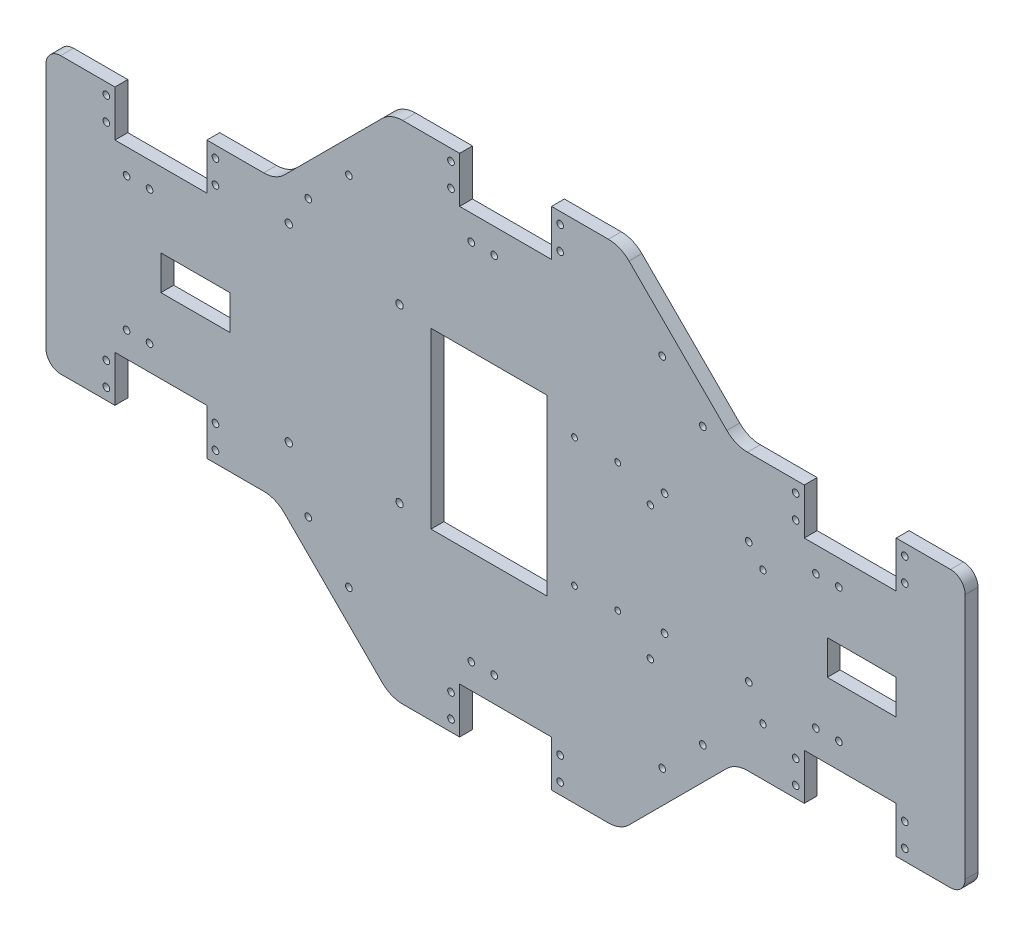
from build123d import *

# Parameters (mm, degrees)
BOSS_EXTRU_1_DEPTH       = 5.6
ENL_V_MAT_EXTRU_1_REACH  = 416.887
ESQUISSE2_W              = 40
ESQUISSE2_H              = 20
ENL_V_MAT_EXTRU_2_REACH  = 416.887
ESQUISSE3_R              = 1.45
SKETCH2_W                = 40
SKETCH2_H                = 20
CUT_EXTRUDE2_DEPTH       = 415.887165384
SKETCH5_R                = 1.45
CUT_EXTRUDE4_DEPTH       = 415.887165384
ESQUISSE4_R              = 1.375
ENL_V_MAT_EXTRU_4_DEPTH  = 415.887165384
ESQUISSE6_R              = 1.45
ENL_V_MAT_EXTRU_6_DEPTH  = 415.887165384
ESQUISSE8_R              = 1.25
ENL_V_MAT_EXTRU_7_DEPTH  = 415.887165384
ESQUISSE9_R              = 1.6
ENL_V_MAT_EXTRU_8_DEPTH  = 415.887165384
ESQUISSE10_W             = 50.45
ESQUISSE10_H             = 75.69
ENL_V_MAT_EXTRU_9_DEPTH  = 415.887165384
ESQUISSE11_W             = 30
ESQUISSE11_H             = 15
ENL_V_MAT_EXTRU_10_DEPTH = 415.887165384
ESQUISSE12_R             = 1.45
ENL_V_MAT_EXTRU_11_DEPTH = 415.887165384
FILLET1_R                = 6.35
FILLET2_R                = 12.7


with BuildPart() as part:
    # Esquisse1 → Boss.-Extru.1 (new body)
    with BuildSketch(Plane.XY):
        Polygon((100, -60), (150, -110), (250, -110), (300, -60), (400, -60), (400, 0), (25.838605695, 0), (0, 0), (0, -60), align=None)
    boss_extru_1 = extrude(amount=BOSS_EXTRU_1_DEPTH)

    # Esquisse2 → Enlèv. mat.-Extru.1 (cut, up to next)
    with BuildSketch(Plane.XY.offset(5.6), mode=Mode.PRIVATE) as enl_v_mat_extru_1_sk1:
        with Locations((50, -50)):
            Rectangle(ESQUISSE2_W, ESQUISSE2_H)
    enl_v_mat_extru_1_tool1 = extrude(enl_v_mat_extru_1_sk1.sketch, amount=-ENL_V_MAT_EXTRU_1_REACH, mode=Mode.PRIVATE) & part.part
    enl_v_mat_extru_1 = enl_v_mat_extru_1_tool1.solids().sort_by_distance((50, -50, 5.6))[0]
    add(enl_v_mat_extru_1, mode=Mode.SUBTRACT)

    # Esquisse3 → Enlèv. mat.-Extru.2 (cut, up to next)
    with BuildSketch(Plane.XY.offset(5.6), mode=Mode.PRIVATE) as enl_v_mat_extru_2_sk1:
        with Locations((26.25, -55.08)):
            Circle(ESQUISSE3_R)
    enl_v_mat_extru_2_tool1 = extrude(enl_v_mat_extru_2_sk1.sketch, amount=-ENL_V_MAT_EXTRU_2_REACH, mode=Mode.PRIVATE) & part.part
    # Esquisse3 → Enlèv. mat.-Extru.2 (cut, up to next)
    with BuildSketch(Plane.XY.offset(5.6), mode=Mode.PRIVATE) as enl_v_mat_extru_2_sk2:
        with Locations((73.75, -55.08)):
            Circle(ESQUISSE3_R)
    enl_v_mat_extru_2_tool2 = extrude(enl_v_mat_extru_2_sk2.sketch, amount=-ENL_V_MAT_EXTRU_2_REACH, mode=Mode.PRIVATE) & part.part
    # Esquisse3 → Enlèv. mat.-Extru.2 (cut, up to next)
    with BuildSketch(Plane.XY.offset(5.6), mode=Mode.PRIVATE) as enl_v_mat_extru_2_sk3:
        with Locations((73.75, -44.92)):
            Circle(ESQUISSE3_R)
    enl_v_mat_extru_2_tool3 = extrude(enl_v_mat_extru_2_sk3.sketch, amount=-ENL_V_MAT_EXTRU_2_REACH, mode=Mode.PRIVATE) & part.part
    # Esquisse3 → Enlèv. mat.-Extru.2 (cut, up to next)
    with BuildSketch(Plane.XY.offset(5.6), mode=Mode.PRIVATE) as enl_v_mat_extru_2_sk4:
        with Locations((26.25, -44.92)):
            Circle(ESQUISSE3_R)
    enl_v_mat_extru_2_tool4 = extrude(enl_v_mat_extru_2_sk4.sketch, amount=-ENL_V_MAT_EXTRU_2_REACH, mode=Mode.PRIVATE) & part.part
    # Esquisse3 → Enlèv. mat.-Extru.2 (cut, up to next)
    with BuildSketch(Plane.XY.offset(5.6), mode=Mode.PRIVATE) as enl_v_mat_extru_2_sk5:
        with Locations((35.06, -29.09)):
            Circle(ESQUISSE3_R)
    enl_v_mat_extru_2_tool5 = extrude(enl_v_mat_extru_2_sk5.sketch, amount=-ENL_V_MAT_EXTRU_2_REACH, mode=Mode.PRIVATE) & part.part
    # Esquisse3 → Enlèv. mat.-Extru.2 (cut, up to next)
    with BuildSketch(Plane.XY.offset(5.6), mode=Mode.PRIVATE) as enl_v_mat_extru_2_sk6:
        with Locations((45.06, -29.09)):
            Circle(ESQUISSE3_R)
    enl_v_mat_extru_2_tool6 = extrude(enl_v_mat_extru_2_sk6.sketch, amount=-ENL_V_MAT_EXTRU_2_REACH, mode=Mode.PRIVATE) & part.part
    enl_v_mat_extru_2_1 = enl_v_mat_extru_2_tool1.solids().sort_by_distance((26.25, -55.08, 5.6))[0]
    add(enl_v_mat_extru_2_1, mode=Mode.SUBTRACT)
    enl_v_mat_extru_2_2 = enl_v_mat_extru_2_tool2.solids().sort_by_distance((73.75, -55.08, 5.6))[0]
    add(enl_v_mat_extru_2_2, mode=Mode.SUBTRACT)
    enl_v_mat_extru_2_3 = enl_v_mat_extru_2_tool3.solids().sort_by_distance((73.75, -44.92, 5.6))[0]
    add(enl_v_mat_extru_2_3, mode=Mode.SUBTRACT)
    enl_v_mat_extru_2_4 = enl_v_mat_extru_2_tool4.solids().sort_by_distance((26.25, -44.92, 5.6))[0]
    add(enl_v_mat_extru_2_4, mode=Mode.SUBTRACT)
    enl_v_mat_extru_2_5 = enl_v_mat_extru_2_tool5.solids().sort_by_distance((35.06, -29.09, 5.6))[0]
    add(enl_v_mat_extru_2_5, mode=Mode.SUBTRACT)
    enl_v_mat_extru_2_6 = enl_v_mat_extru_2_tool6.solids().sort_by_distance((45.06, -29.09, 5.6))[0]
    add(enl_v_mat_extru_2_6, mode=Mode.SUBTRACT)
    enl_v_mat_extru_2 = enl_v_mat_extru_2_1 + enl_v_mat_extru_2_2 + enl_v_mat_extru_2_3 + enl_v_mat_extru_2_4 + enl_v_mat_extru_2_5 + enl_v_mat_extru_2_6  # Enlèv. mat.-Extru.2 as one shape, for the pattern or mirror that repeats it

    # Sketch2 → Cut-Extrude2 (cut, symmetric)
    with BuildSketch(Plane.XY):
        with Locations((350, -50)):
            Rectangle(SKETCH2_W, SKETCH2_H)
        with Locations((200, -100)):
            Rectangle(SKETCH2_W, SKETCH2_H)
    cut_extrude2 = extrude(amount=CUT_EXTRUDE2_DEPTH, both=True, mode=Mode.SUBTRACT)

    # Sketch5 → Cut-Extrude4 (cut, through all)
    with BuildSketch(Plane.XY):
        with Locations((176.25, -105.08)):
            Circle(SKETCH5_R)
        with Locations((223.75, -105.08)):
            Circle(SKETCH5_R)
        with Locations(Location((223.75, -94.92, 0), (0, 0, 180))):
            Circle(SKETCH5_R)
        with Locations(Location((176.25, -94.92, 0), (0, 0, 180))):
            Circle(SKETCH5_R)
        with Locations((326.25, -55.08)):
            Circle(SKETCH5_R)
        with Locations((373.75, -55.08)):
            Circle(SKETCH5_R)
        with Locations(Location((373.75, -44.92, 0), (0, 0, 180))):
            Circle(SKETCH5_R)
        with Locations(Location((326.25, -44.92, 0), (0, 0, 180))):
            Circle(SKETCH5_R)
        with Locations((185.06, -79.09)):
            Circle(SKETCH5_R)
        with Locations((195.06, -79.09)):
            Circle(SKETCH5_R)
        with Locations((335.06, -29.09)):
            Circle(SKETCH5_R)
        with Locations((345.06, -29.09)):
            Circle(SKETCH5_R)
    cut_extrude4 = extrude(amount=CUT_EXTRUDE4_DEPTH, mode=Mode.SUBTRACT)

    # Mirror1: Boss.-Extru.1, Enlèv. mat.-Extru.1, Enlèv. mat.-Extru.2, Cut-Extrude2, Cut-Extrude4 across plane
    add(boss_extru_1.mirror(Plane.ZX))
    add(enl_v_mat_extru_1.mirror(Plane.ZX), mode=Mode.SUBTRACT)
    add(enl_v_mat_extru_2.mirror(Plane.ZX), mode=Mode.SUBTRACT)
    add(cut_extrude2.mirror(Plane.ZX), mode=Mode.SUBTRACT)
    add(cut_extrude4.mirror(Plane.ZX), mode=Mode.SUBTRACT)

    # Esquisse4 → Enlèv. mat.-Extru.4 (cut, through all)
    with BuildSketch(Plane.XY.offset(5.6)):
        with Locations((263, -39)):
            Circle(ESQUISSE4_R)
        with Locations((312, -39)):
            Circle(ESQUISSE4_R)
        with Locations((312, 19)):
            Circle(ESQUISSE4_R)
        with Locations((263, 19)):
            Circle(ESQUISSE4_R)
    extrude(amount=-ENL_V_MAT_EXTRU_4_DEPTH, mode=Mode.SUBTRACT)

    # Esquisse6 → Enlèv. mat.-Extru.6 (cut, through all)
    with BuildSketch(Plane(origin=(0, 0, 0), x_dir=(-1, 0, 0), z_dir=(0, 0, -1))):
        with Locations((-269.19, -26.31)):
            Circle(ESQUISSE6_R)
        with Locations((-305.82, -26.31)):
            Circle(ESQUISSE6_R)
        with Locations((-305.82, 26.52)):
            Circle(ESQUISSE6_R)
        with Locations((-269.19, 26.52)):
            Circle(ESQUISSE6_R)
    extrude(amount=-ENL_V_MAT_EXTRU_6_DEPTH, mode=Mode.SUBTRACT)

    # Esquisse8 → Enlèv. mat.-Extru.7 (cut, through all)
    with BuildSketch(Plane(origin=(0, 0, 0), x_dir=(-1, 0, 0), z_dir=(0, 0, -1))):
        with Locations((-230, 27.95)):
            Circle(ESQUISSE8_R)
        with Locations((-248.8, 27.95)):
            Circle(ESQUISSE8_R)
        with Locations((-248.8, -27.95)):
            Circle(ESQUISSE8_R)
        with Locations((-230, -27.95)):
            Circle(ESQUISSE8_R)
    extrude(amount=-ENL_V_MAT_EXTRU_7_DEPTH, mode=Mode.SUBTRACT)

    # Esquisse9 → Enlèv. mat.-Extru.8 (cut, through all)
    with BuildSketch(Plane(origin=(0, 0, 0), x_dir=(-1, 0, 0), z_dir=(0, 0, -1))):
        with Locations((-153.85903462, -34.88)):
            Circle(ESQUISSE9_R)
        with Locations((-105.63903462, -36.11)):
            Circle(ESQUISSE9_R)
        with Locations((-105.63903462, 46.36)):
            Circle(ESQUISSE9_R)
        with Locations((-153.85903462, 40)):
            Circle(ESQUISSE9_R)
    extrude(amount=-ENL_V_MAT_EXTRU_8_DEPTH, mode=Mode.SUBTRACT)

    # Esquisse10 → Enlèv. mat.-Extru.9 (cut, through all)
    with BuildSketch(Plane(origin=(0, 0, 0), x_dir=(-1, 0, 0), z_dir=(0, 0, -1))):
        with Locations((-192.775, -0.005)):
            Rectangle(ESQUISSE10_W, ESQUISSE10_H)
    extrude(amount=-ENL_V_MAT_EXTRU_9_DEPTH, mode=Mode.SUBTRACT)

    # Esquisse11 → Enlèv. mat.-Extru.10 (cut, through all)
    with BuildSketch(Plane(origin=(0, 0, 0), x_dir=(-1, 0, 0), z_dir=(0, 0, -1))):
        with Locations((-355, 0)):
            Rectangle(ESQUISSE11_W, ESQUISSE11_H)
        with Locations((-65, 0)):
            Rectangle(ESQUISSE11_W, ESQUISSE11_H)
    extrude(amount=-ENL_V_MAT_EXTRU_10_DEPTH, mode=Mode.SUBTRACT)

    # Esquisse12 → Enlèv. mat.-Extru.11 (cut, through all)
    with BuildSketch(Plane.XY.offset(5.6)):
        with Locations((131.819805153, 77.67766953)):
            Circle(ESQUISSE12_R)
        with Locations((114.142135624, 60)):
            Circle(ESQUISSE12_R)
        with Locations(Location((285.857864376, 60, 0), (0, 0, 180))):
            Circle(ESQUISSE12_R)
        with Locations(Location((268.180194847, 77.67766953, 0), (0, 0, 180))):
            Circle(ESQUISSE12_R)
        with Locations((285.857864376, -60)):
            Circle(ESQUISSE12_R)
        with Locations((268.180194847, -77.67766953)):
            Circle(ESQUISSE12_R)
        with Locations(Location((131.819805153, -77.67766953, 0), (0, 0, 180))):
            Circle(ESQUISSE12_R)
        with Locations(Location((114.142135624, -60, 0), (0, 0, 180))):
            Circle(ESQUISSE12_R)
    extrude(amount=-ENL_V_MAT_EXTRU_11_DEPTH, mode=Mode.SUBTRACT)

    # Fillet1
    fillet1_edges = [part.edges().sort_by_distance(p)[0] for p in [
        (0, 60, 2.8),
        (400, 60, 2.8),
        (0, -60, 2.8),
        (400, -60, 2.8),
    ]]
    fillet(fillet1_edges, radius=FILLET1_R)

    # Fillet2
    fillet2_edges = [part.edges().sort_by_distance(p)[0] for p in [
        (100, 60, 2.8),
        (300, 60, 2.8),
        (250, 110, 2.8),
        (150, 110, 2.8),
        (300, -60, 2.8),
        (250, -110, 2.8),
        (150, -110, 2.8),
        (100, -60, 2.8),
    ]]
    fillet(fillet2_edges, radius=FILLET2_R)


solid = part.part
